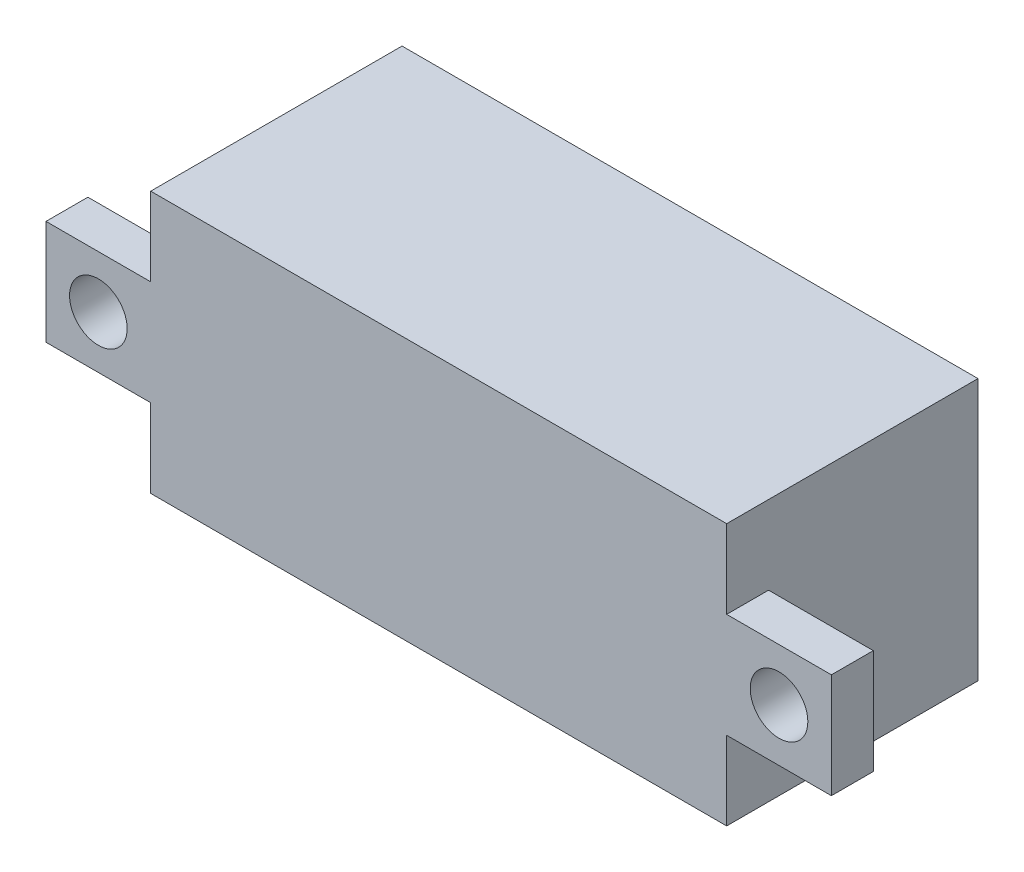
from build123d import *

# Parameters (mm, degrees)
SKETCH_1_W      = 22
SKETCH_1_H      = 10
EXTRUDE_1_DEPTH = 8
SKETCH_2_R      = 1.1
EXTRUDE_2_DEPTH = 1.6


with BuildPart() as part:
    # 草图1 → 凸台-拉伸1 (new body)
    with BuildSketch(Plane.XY):
        with Locations((11, 5)):
            Rectangle(SKETCH_1_W, SKETCH_1_H)
    extrude(amount=EXTRUDE_1_DEPTH)

    # 草图2 → 凸台-拉伸2 (add)
    with BuildSketch(Plane.XY.offset(8)):
        Polygon((0, 7), (-4, 7), (-4, 3), (0, 3), (0, 0), (22, 0), (22, 3), (26, 3), (26, 7), (22, 7), (22, 10), (0, 10), align=None)
        with Locations((-2, 5)):
            Circle(SKETCH_2_R, mode=Mode.SUBTRACT)
        with Locations((24, 5)):
            Circle(SKETCH_2_R, mode=Mode.SUBTRACT)
    extrude(amount=EXTRUDE_2_DEPTH)


solid = part.part
